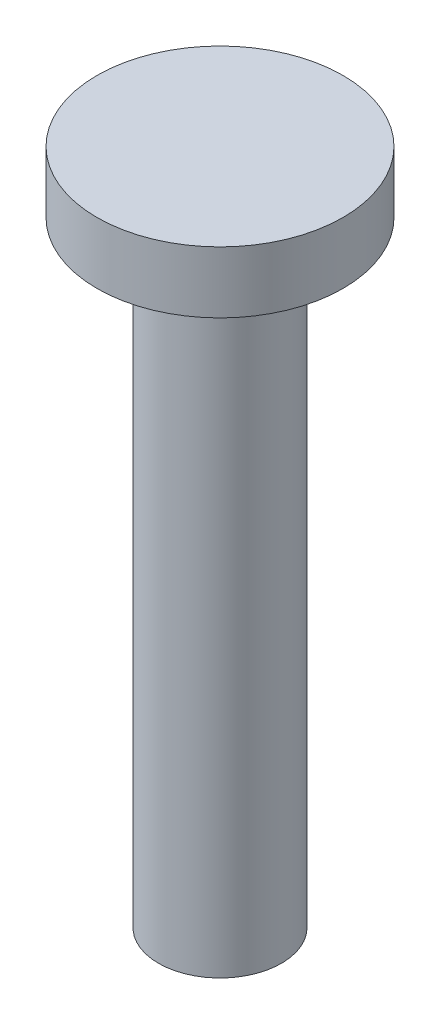
from build123d import *

# Parameters (mm, degrees)
SKETCH1_R           = 3.175
BOSS_EXTRUDE1_DEPTH = 31.75
SKETCH2_R           = 6.35
BOSS_EXTRUDE2_DEPTH = 3.175


with BuildPart() as part:
    # Sketch1 → Boss-Extrude1 (new body)
    with BuildSketch(Plane(origin=(0, 0, 0), x_dir=(1, 0, 0), z_dir=(0, 1, 0))):
        with Locations(Location((0, 0, 0), (0, 0, 270))):
            Circle(SKETCH1_R)
    extrude(amount=BOSS_EXTRUDE1_DEPTH)

    # Sketch2 → Boss-Extrude2 (add)
    with BuildSketch(Plane(origin=(0, 31.75, 0), x_dir=(1, 0, 0), z_dir=(0, 1, 0))):
        with Locations(Location((0, 0, 0), (0, 0, 270))):
            Circle(SKETCH2_R)
    extrude(amount=BOSS_EXTRUDE2_DEPTH)


solid = part.part
